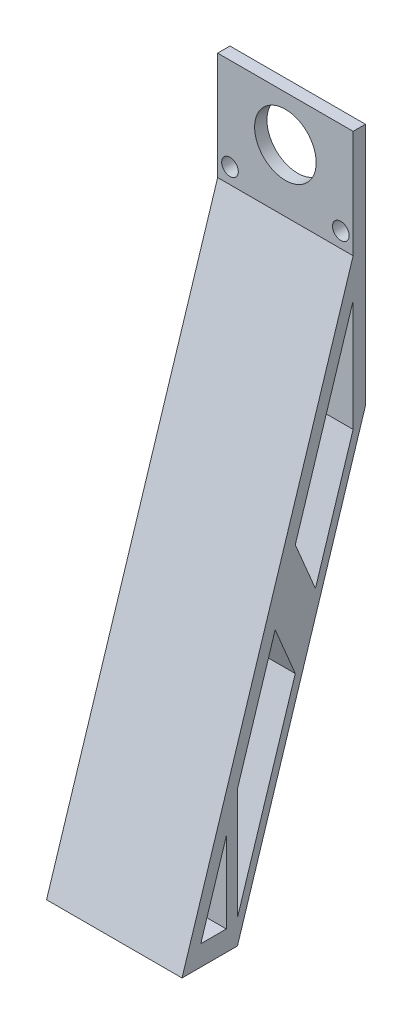
from build123d import *

# Parameters (mm, degrees)
SKETCH1_W            = 1117.6
SKETCH1_H            = 889
BOSS_EXTRUDE1_DEPTH  = 101.6
SKETCH6_R            = 68.58
SKETCH6_R_2          = 254
CUT_EXTRUDE1_DEPTH   = 492.76
BOSS_EXTRUDE4_DEPTH  = 1117.6
BOSS_EXTRUDE6_DEPTH  = 1117.6
BOSS_EXTRUDE7_DEPTH  = 1117.6
BOSS_EXTRUDE8_DEPTH  = 1117.6
BOSS_EXTRUDE9_DEPTH  = 1117.6
BOSS_EXTRUDE10_DEPTH = 1117.6


with BuildPart() as part:
    # Sketch1 → Boss-Extrude1 (new body)
    with BuildSketch(Plane.XY):
        with Locations((558.8, 444.5)):
            Rectangle(SKETCH1_W, SKETCH1_H)
    extrude(amount=BOSS_EXTRUDE1_DEPTH)

    # Sketch6 → Cut-Extrude1 (cut)
    with BuildSketch(Plane.XY.offset(101.6)):
        with Locations((1016, 127)):
            Circle(SKETCH6_R)
        with Locations((101.6, 127)):
            Circle(SKETCH6_R)
        with Locations((558.8, 513.08)):
            Circle(SKETCH6_R_2)
    extrude(amount=-CUT_EXTRUDE1_DEPTH, mode=Mode.SUBTRACT)

    # Sketch12 → Boss-Extrude4 (add)
    with BuildSketch(Plane(origin=(0, 0, 0), x_dir=(0, 0, -1), z_dir=(1, 0, 0))):
        Polygon((0, 0), (-1411.432447732, -4453.928101196), (-1513.032447732, -4453.928101196), (-101.6, 0), align=None)
    extrude(amount=BOSS_EXTRUDE4_DEPTH)

    # Sketch18 → Boss-Extrude6 (add)
    with BuildSketch(Plane.ZY):
        Polygon((1411.432447732, -4453.928101196), (1055.832447732, -4453.928101196), (1055.832447732, -4286.375258564), (1358.335605254, -4286.375258564), align=None)
    extrude(amount=-BOSS_EXTRUDE6_DEPTH)

    # Sketch19 → Boss-Extrude7 (add)
    with BuildSketch(Plane.ZY):
        Polygon((1055.832447732, -4286.375258564), (1055.832447732, -3331.793750855), (1147.60027144, -3621.377067049), (1147.60027144, -4288.358100244), (1145.651853781, -4286.375258564), align=None)
    extrude(amount=-BOSS_EXTRUDE7_DEPTH)

    # Sketch24 → Boss-Extrude8 (add)
    with BuildSketch(Plane.ZY):
        Polygon((101.6, -1240.567708283), (1055.832447732, -4251.751644756), (1055.832447732, -4453.928101196), (101.6, -1442.744164723), align=None)
    extrude(amount=-BOSS_EXTRUDE8_DEPTH)

    # Sketch22 → Boss-Extrude9 (add)
    with BuildSketch(Plane.ZY):
        Polygon((101.6, -1442.744164723), (101.6, -320.609814383), (0, 0), (0, -1122.13435034), align=None)
    extrude(amount=-BOSS_EXTRUDE9_DEPTH)

    # Sketch27 → Boss-Extrude10 (add)
    with BuildSketch(Plane.ZY):
        Polygon((578.716223866, -2746.159676519), (744.785924807, -2350.252727434), (578.716223866, -1826.201782619), (412.646522926, -2222.108731705), align=None)
    extrude(amount=-BOSS_EXTRUDE10_DEPTH)


solid = part.part
